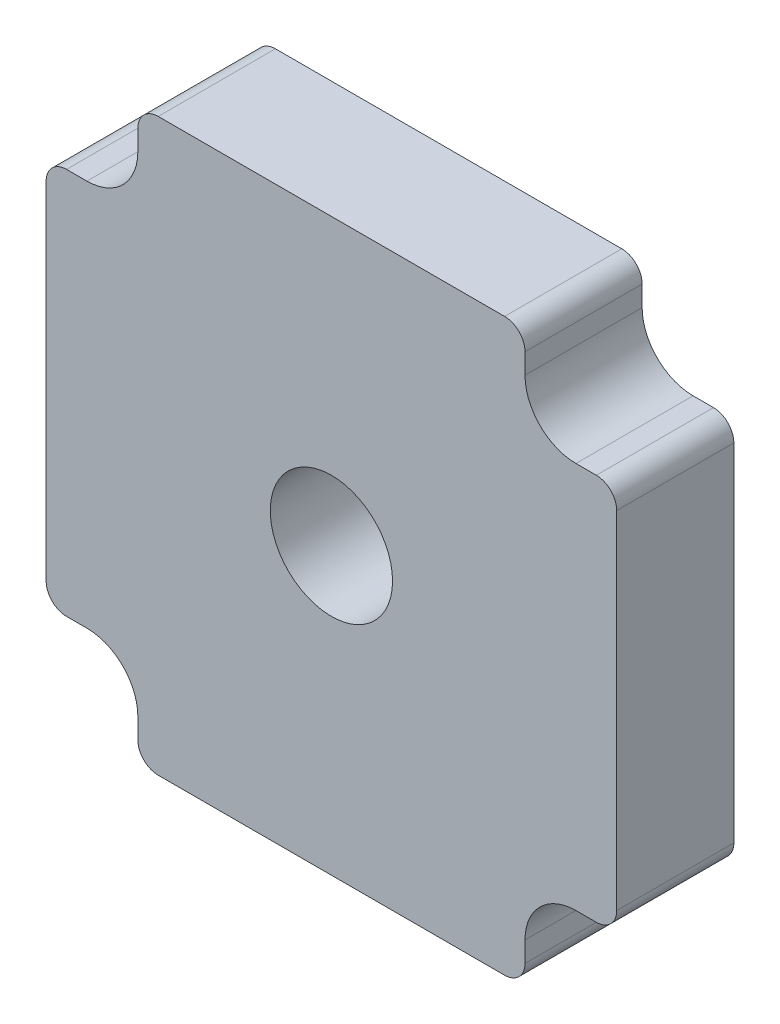
from build123d import *

# Parameters (mm, degrees)
SKETCH1_W           = 56
SKETCH1_H           = 56
BOSS_EXTRUDE1_DEPTH = 11.5
SKETCH2_W           = 9
SKETCH2_H           = 9
CUT_EXTRUDE1_DEPTH  = 11.5
CIRPATTERN1_COUNT   = 4
FILLET1_R           = 5
FILLET2_R           = 2
SKETCH3_R           = 6
CUT_EXTRUDE2_DEPTH  = 11.5


with BuildPart() as part:
    # Sketch1 → Boss-Extrude1 (new body)
    with BuildSketch(Plane.XY):
        Rectangle(SKETCH1_W, SKETCH1_H)
    extrude(amount=BOSS_EXTRUDE1_DEPTH)

    # Sketch2 → Cut-Extrude1 (cut)
    with BuildSketch(Plane.XY.offset(11.5)):
        with Locations((23.5, 23.5)):
            Rectangle(SKETCH2_W, SKETCH2_H)
    cut_extrude1 = extrude(amount=-CUT_EXTRUDE1_DEPTH, mode=Mode.SUBTRACT)

    # CirPattern1: Cut-Extrude1 ×4 about axis
    cirpattern1_axis = Axis((0, 0, -0.575), (0, 0, 1))
    for i in range(1, CIRPATTERN1_COUNT):
        add(cut_extrude1.rotate(cirpattern1_axis, i * 360 / CIRPATTERN1_COUNT), mode=Mode.SUBTRACT)

    # Fillet1
    fillet1_edges = [part.edges().sort_by_distance(p)[0] for p in [
        (-19, 19, 5.75),
        (-19, -19, 5.75),
        (19, -19, 5.75),
        (19, 19, 5.75),
    ]]
    fillet(fillet1_edges, radius=FILLET1_R)

    # Fillet2
    fillet2_edges = [part.edges().sort_by_distance(p)[0] for p in [
        (-28, 19, 5.75),
        (-19, 28, 5.75),
        (-19, -28, 5.75),
        (-28, -19, 5.75),
        (19, -28, 5.75),
        (28, -19, 5.75),
        (28, 19, 5.75),
        (19, 28, 5.75),
    ]]
    fillet(fillet2_edges, radius=FILLET2_R)

    # Sketch3 → Cut-Extrude2 (cut)
    with BuildSketch(Plane.XY.offset(11.5)):
        Circle(SKETCH3_R)
    extrude(amount=-CUT_EXTRUDE2_DEPTH, mode=Mode.SUBTRACT)


solid = part.part
